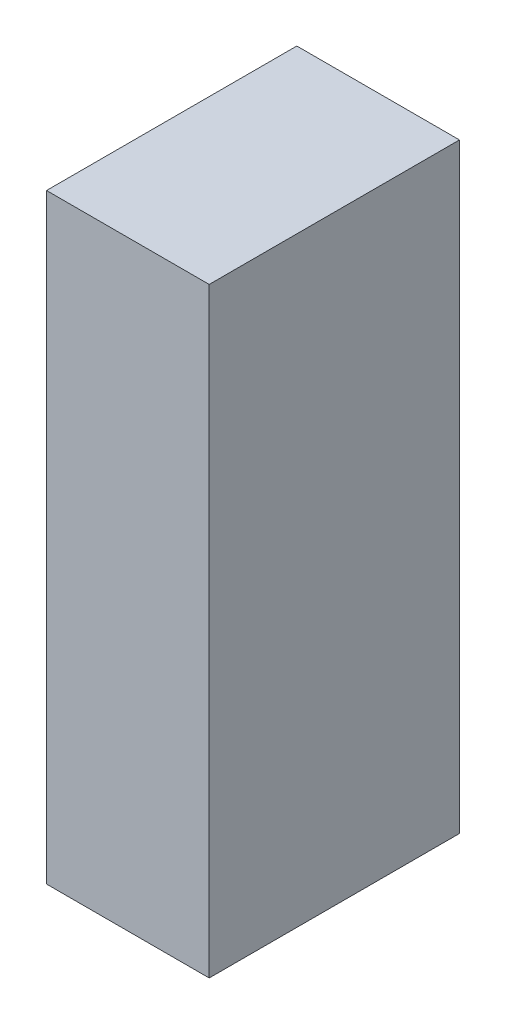
from build123d import *

# Parameters (mm, degrees)
ESQUISSE1_W        = 65
ESQUISSE1_H        = 240
BOSS_EXTRU_1_DEPTH = 100


with BuildPart() as part:
    # Esquisse1 → Boss.-Extru.1 (new body)
    with BuildSketch(Plane.XY):
        with Locations((-32.5, 120)):
            Rectangle(ESQUISSE1_W, ESQUISSE1_H)
    extrude(amount=BOSS_EXTRU_1_DEPTH)


solid = part.part
